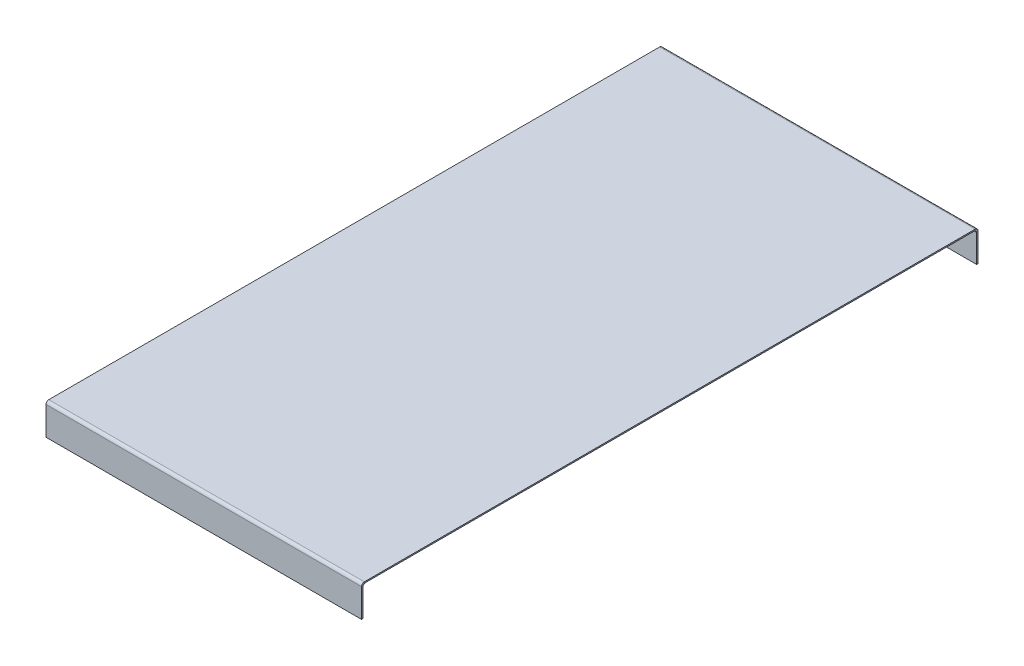
from build123d import *

# Parameters (mm, degrees)
BOSS_EXTRUDE1_DEPTH = 225
FILLET1_R           = 2
FILLET2_R           = 2


with BuildPart() as part:
    # Sketch1 → Boss-Extrude1 (new body)
    with BuildSketch(Plane(origin=(0, 0, 0), x_dir=(0, 0, -1), z_dir=(1, 0, 0))):
        Polygon((-25.797072277, -87.459332388), (-25.797072277, -65.229332388), (413.812927723, -65.229332388), (413.812927723, -87.549332388), (412.812927723, -87.549332388), (412.812927723, -66.130301409), (-24.797072277, -66.130301409), (-24.797072277, -87.459332388), align=None)
    extrude(amount=BOSS_EXTRUDE1_DEPTH)

    # Fillet1
    fillet1_edges = [part.edges().sort_by_distance(p)[0] for p in [
        (112.5, -65.229332388, 25.797072277),
        (112.5, -65.229332388, -413.812927723),
    ]]
    fillet(fillet1_edges, radius=FILLET1_R)

    # Fillet2
    fillet2_edges = [part.edges().sort_by_distance(p)[0] for p in [
        (112.5, -66.130301409, -412.812927723),
        (112.5, -66.130301409, 24.797072277),
    ]]
    fillet(fillet2_edges, radius=FILLET2_R)


solid = part.part
